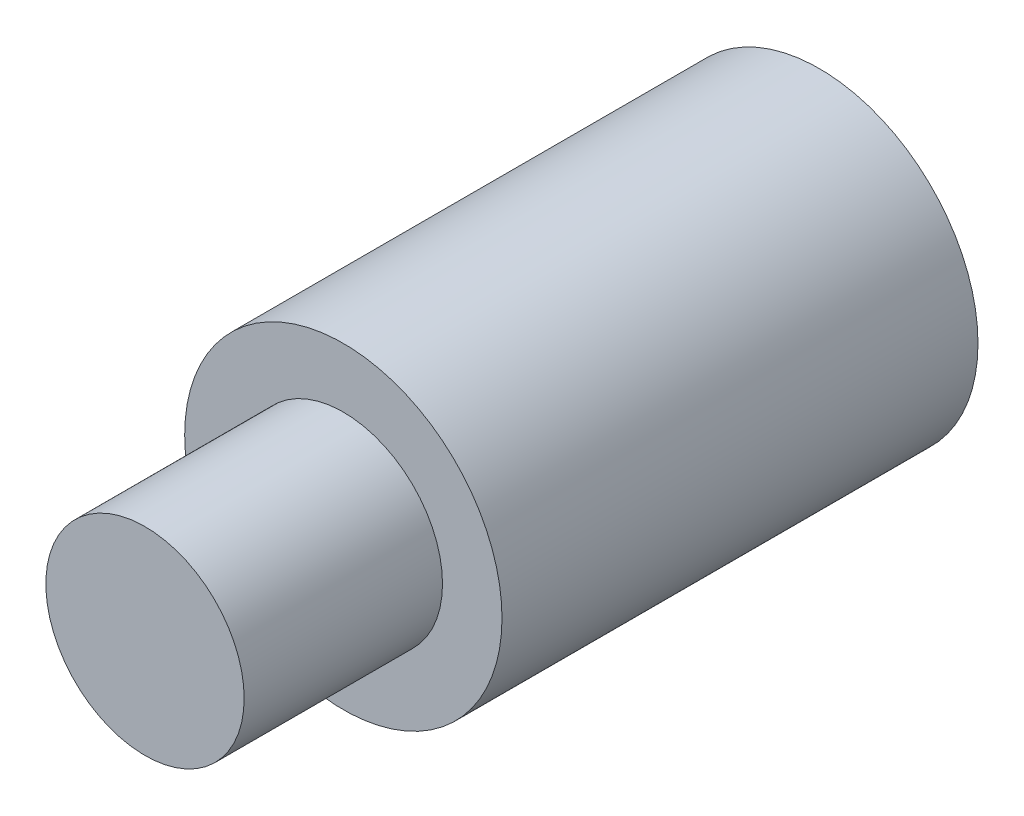
from build123d import *

# Parameters (mm, degrees)
ESQUISSE1_R        = 2.5
BOSS_EXTRU_1_DEPTH = 5
ESQUISSE3_R        = 4
BOSS_EXTRU_2_DEPTH = 12


with BuildPart() as part:
    # Esquisse1 → Boss.-Extru.1 (new body)
    with BuildSketch(Plane.XY):
        Circle(ESQUISSE1_R)
    extrude(amount=BOSS_EXTRU_1_DEPTH)

    # Esquisse3 → Boss.-Extru.2 (add)
    with BuildSketch(Plane.XY):
        Circle(ESQUISSE3_R)
    extrude(amount=-BOSS_EXTRU_2_DEPTH)


solid = part.part
